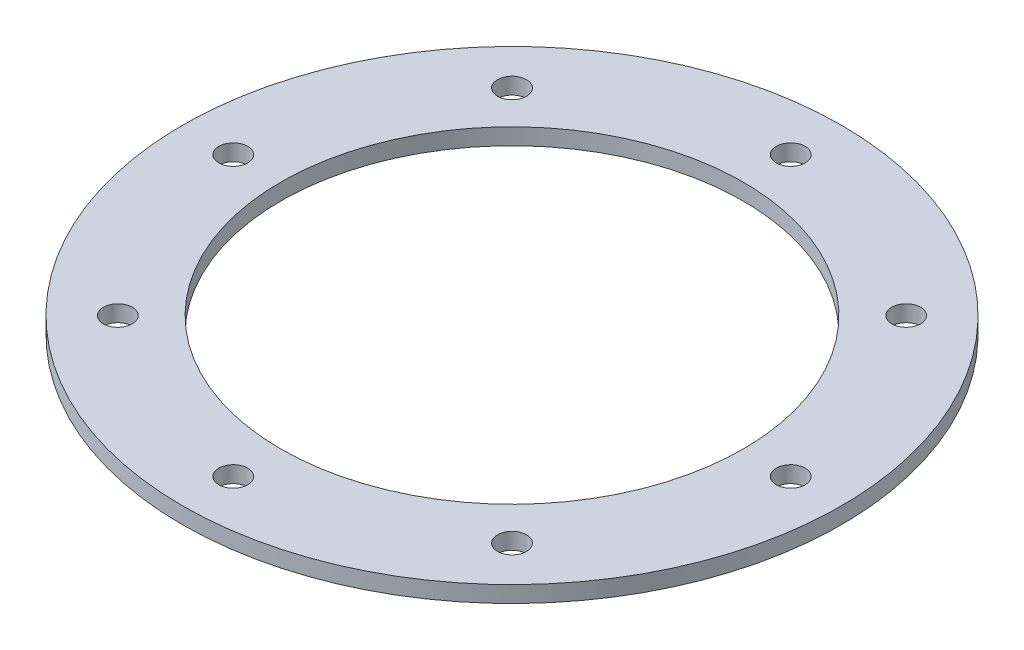
from build123d import *

# Parameters (mm, degrees)
SKETCH_1_R      = 100.5
SKETCH_1_R_2    = 70.5
SKETCH_1_R_3    = 4.4
EXTRUDE_1_DEPTH = 5


with BuildPart() as part:
    # Эскиз1 → Бобышка-Вытянуть1 (new body)
    with BuildSketch(Plane(origin=(0, 0, 0), x_dir=(1, 0, 0), z_dir=(0, 1, 0))):
        with Locations(Location((0, 0, 0), (0, 0, 270))):
            Circle(SKETCH_1_R)
        with Locations(Location((0, 0, 0), (0, 0, 270))):
            Circle(SKETCH_1_R_2, mode=Mode.SUBTRACT)
        with Locations(Location((85, 0, 0), (0, 0, 270))):
            Circle(SKETCH_1_R_3, mode=Mode.SUBTRACT)
        with Locations(Location((60.104076401, -60.104076401, 0), (0, 0, 270))):
            Circle(SKETCH_1_R_3, mode=Mode.SUBTRACT)
        with Locations(Location((0, -85, 0), (0, 0, 270))):
            Circle(SKETCH_1_R_3, mode=Mode.SUBTRACT)
        with Locations(Location((-60.104076401, -60.104076401, 0), (0, 0, 270))):
            Circle(SKETCH_1_R_3, mode=Mode.SUBTRACT)
        with Locations(Location((-85, 0, 0), (0, 0, 270))):
            Circle(SKETCH_1_R_3, mode=Mode.SUBTRACT)
        with Locations(Location((-60.104076401, 60.104076401, 0), (0, 0, 270))):
            Circle(SKETCH_1_R_3, mode=Mode.SUBTRACT)
        with Locations(Location((0, 85, 0), (0, 0, 270))):
            Circle(SKETCH_1_R_3, mode=Mode.SUBTRACT)
        with Locations(Location((60.104076401, 60.104076401, 0), (0, 0, 270))):
            Circle(SKETCH_1_R_3, mode=Mode.SUBTRACT)
    extrude(amount=EXTRUDE_1_DEPTH)


solid = part.part
